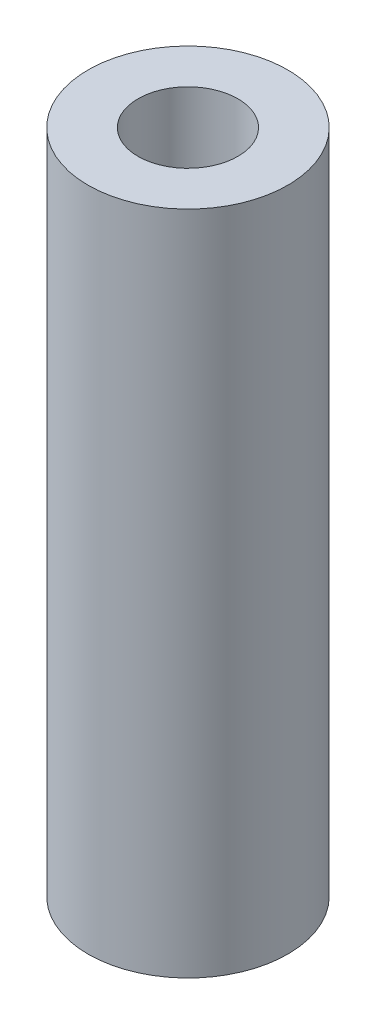
from build123d import *

# Parameters (mm, degrees)
SKETCH_1_R      = 3
SKETCH_1_R_2    = 1.5
EXTRUDE_1_DEPTH = 20


with BuildPart() as part:
    # 草图1 → 凸台-拉伸1 (new body)
    with BuildSketch(Plane(origin=(0, 0, 0), x_dir=(1, 0, 0), z_dir=(0, 1, 0))):
        with Locations(Location((0, 0, 0), (0, 0, 270))):
            Circle(SKETCH_1_R)
        with Locations(Location((0, 0, 0), (0, 0, 270))):
            Circle(SKETCH_1_R_2, mode=Mode.SUBTRACT)
    extrude(amount=EXTRUDE_1_DEPTH)


solid = part.part
